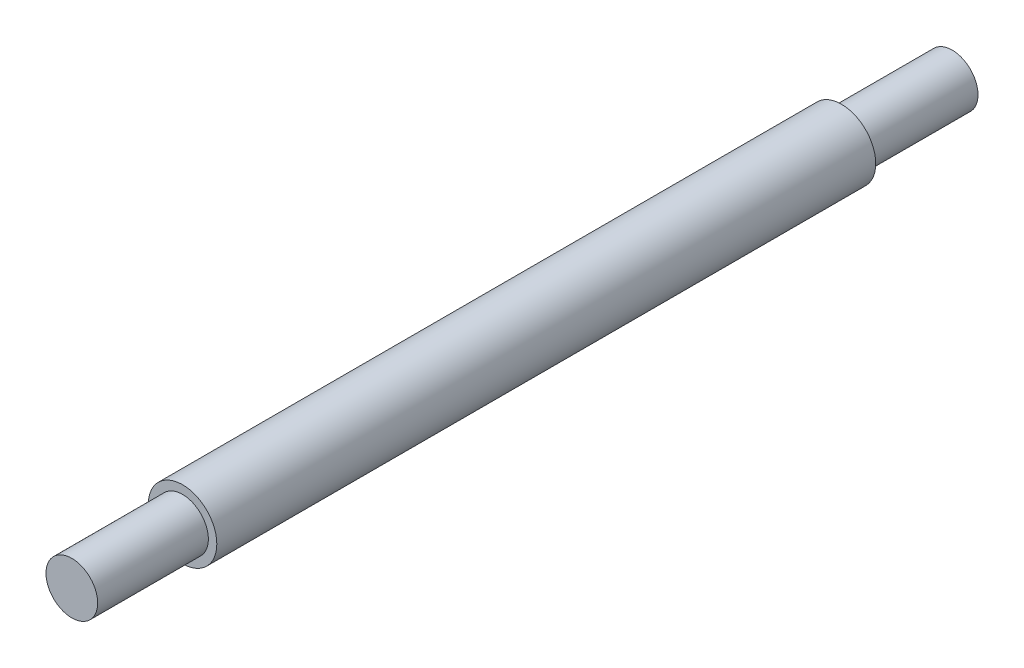
from build123d import *

# Parameters (mm, degrees)
SKETCH_1_R      = 6.5
EXTRUDE_1_DEPTH = 125
SKETCH_2_R      = 4.9
EXTRUDE_2_DEPTH = 21
EXTRUDE_START   = 21
SKETCH_3_R      = 4.9
EXTRUDE_3_DEPTH = 21


with BuildPart() as part:
    # 草图1 → 凸台-拉伸1 (new body)
    with BuildSketch(Plane.XY):
        Circle(SKETCH_1_R)
    extrude(amount=EXTRUDE_1_DEPTH)

    # 草图2 → 凸台-拉伸2 (add)
    with BuildSketch(Plane.XY.offset(125)):
        with Locations(Location((0, 0, 0), (0, 0, 180))):
            Circle(SKETCH_2_R)
    extrude(amount=EXTRUDE_2_DEPTH)

    # 草图3 → 凸台-拉伸3 (add)
    with BuildSketch(Plane(origin=(0, 0, 0), x_dir=(-1, 0, 0), z_dir=(0, 0, -1)).offset(EXTRUDE_START)):
        Circle(SKETCH_3_R)
    extrude(amount=-EXTRUDE_3_DEPTH)


solid = part.part
